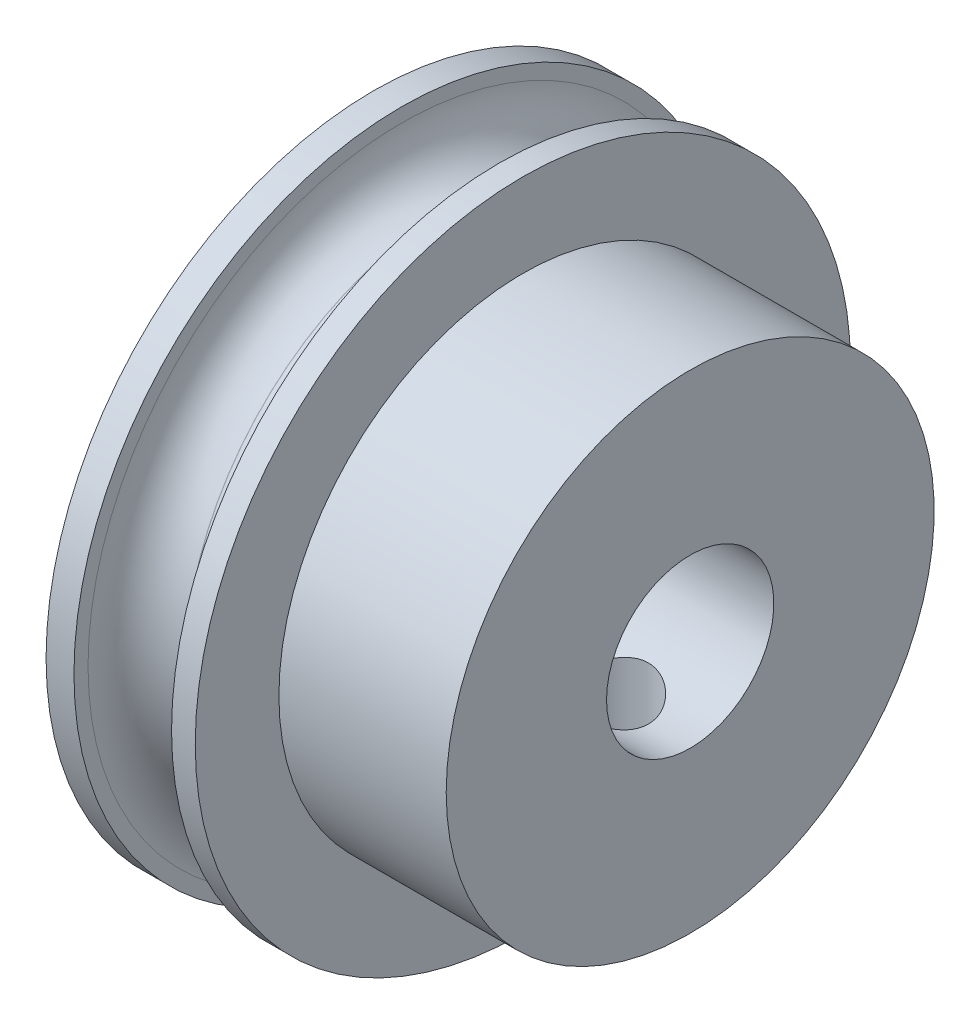
from build123d import *

# Parameters (mm, degrees)
CUT_EXTRUDE_1_REACH      = 42.247
CUT_EXTRUDE_1_END_RADIUS = 17.5
SKETCH_2_R               = 3


with BuildPart() as part:
    # Sketch 258 → Повернуть1 (revolve)
    with BuildSketch(Plane.XY, mode=Mode.PRIVATE) as revolve_1_sk:
        with BuildLine():
            Line((0, 6), (22.7, 6))
            Line((22.7, 6), (22.7, 17.5))
            Line((22.7, 17.5), (10.7, 17.5))
            Line((10.7, 17.5), (10.7, 23.5))
            Line((10.7, 23.5), (9, 23.5))
            Line((9, 23.5), (9, 22.49))
            ThreePointArc((9, 22.49), (7.977802666, 20.022197334), (5.51, 19))
            Line((5.51, 19), (5.49, 19))
            ThreePointArc((5.49, 19), (3.022197334, 20.022197334), (2, 22.49))
            Line((2, 22.49), (2, 23.5))
            Line((2, 23.5), (0, 23.5))
            Line((0, 23.5), (0, 6))
        make_face()
    revolve(revolve_1_sk.sketch.rotate(Axis((0, 0, 0), (1, 0, 0)), 90), axis=Axis((0, 0, 0), (1, 0, 0)))

    # Вырез-Вытянуть1: up to this cylinder (the profile starts inside it)
    cut_extrude_1_end = Plane(origin=(16.7, 0, 0), z_dir=(-1, 0, 0)) * Cylinder(CUT_EXTRUDE_1_END_RADIUS, 120.494, mode=Mode.PRIVATE)
    # Эскиз2 → Вырез-Вытянуть1 (cut, up to the surface)
    with BuildSketch(Plane(origin=(0, 0, 0), x_dir=(1, 0, 0), z_dir=(0, 1, 0)), mode=Mode.PRIVATE) as cut_extrude_1_sk1:
        with Locations(Location((16.7, 0, 0), (0, 0, 270))):
            Circle(SKETCH_2_R)
    cut_extrude_1_tool1 = extrude(cut_extrude_1_sk1.sketch, amount=-CUT_EXTRUDE_1_REACH, mode=Mode.PRIVATE) & cut_extrude_1_end
    add(cut_extrude_1_tool1.solids().sort_by_distance((16.7, 0, 0))[0], mode=Mode.SUBTRACT)


solid = part.part
